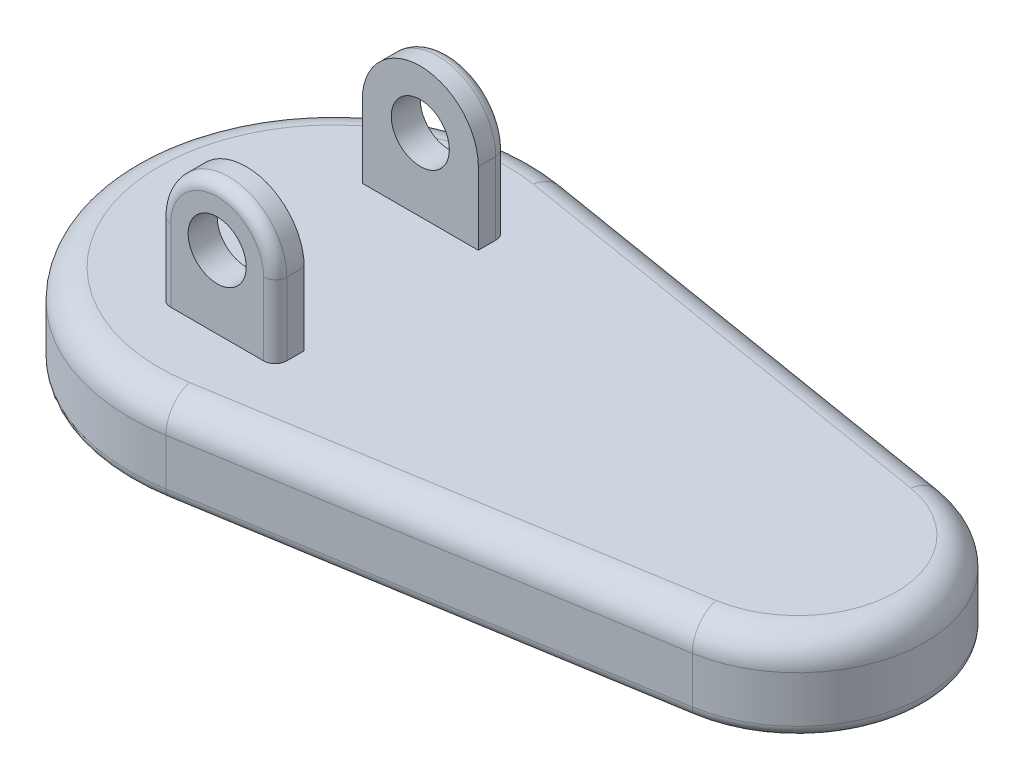
from build123d import *

# Parameters (mm, degrees)
BOSS_EXTRUDE1_DEPTH = 19.05
SKETCH2_W           = 25.4
SKETCH2_H           = 6.35
BOSS_EXTRUDE2_DEPTH = 38.1
SKETCH3_R           = 6.35
CUT_EXTRUDE1_DEPTH  = 172.685024099
FILLET1_R           = 6.35
FILLET2_R           = 2.54
FILLET3_R           = 2.54


with BuildPart() as part:
    # Sketch1 → Boss-Extrude1 (new body)
    with BuildSketch(Plane(origin=(0, 0, 0), x_dir=(1, 0, 0), z_dir=(0, 1, 0))):
        with BuildLine():
            Line((-94.376875, 43.859194763), (4.54025, 27.568636708))
            ThreePointArc((4.54025, 27.568636708), (27.94, 0), (4.54025, -27.568636708))
            Line((4.54025, -27.568636708), (-94.376875, -43.859194763))
            ThreePointArc((-94.376875, -43.859194763), (-146.05, 0), (-94.376875, 43.859194763))
        make_face()
    extrude(amount=BOSS_EXTRUDE1_DEPTH)

    # Sketch2 → Boss-Extrude2 (add)
    with BuildSketch(Plane(origin=(0, 19.05, 0), x_dir=(1, 0, 0), z_dir=(0, 1, 0))):
        with Locations((-101.6, 22.225)):
            Rectangle(SKETCH2_W, SKETCH2_H)
        with Locations((-101.6, -22.225)):
            Rectangle(SKETCH2_W, SKETCH2_H)
    extrude(amount=BOSS_EXTRUDE2_DEPTH)

    # Sketch3 → Cut-Extrude1 (cut, through all)
    with BuildSketch(Plane.XY.offset(25.4)):
        with BuildLine():
            Line((-114.3, 57.15), (-114.3, 34.925))
            ThreePointArc((-114.3, 34.925), (-101.6, 47.625), (-88.9, 34.925))
            Line((-88.9, 34.925), (-88.9, 57.15))
            Line((-88.9, 57.15), (-114.3, 57.15))
        make_face()
        with Locations((-101.6, 34.925)):
            Circle(SKETCH3_R)
    extrude(amount=-CUT_EXTRUDE1_DEPTH, mode=Mode.SUBTRACT)

    # Fillet1
    fillet1_edges = [part.edges().sort_by_distance(p)[0] for p in [
        (27.94, 19.05, 0),
        (-44.9183125, 19.05, -35.713915735),
        (-146.05, 19.05, 0),
        (-44.9183125, 19.05, 35.713915735),
    ]]
    fillet(fillet1_edges, radius=FILLET1_R)

    # Fillet2
    fillet2_edges = [part.edges().sort_by_distance(p)[0] for p in [
        (-44.9183125, 0, -35.713915735),
        (27.94, 0, 0),
        (-44.9183125, 0, 35.713915735),
        (-146.05, 0, 0),
    ]]
    fillet(fillet2_edges, radius=FILLET2_R)

    # Fillet3
    fillet3_edges = [part.edges().sort_by_distance(p)[0] for p in [
        (-88.9, 26.9875, 25.4),
        (-114.3, 26.9875, 25.4),
        (-114.3, 26.9875, -25.4),
        (-88.9, 26.9875, -25.4),
        (-101.6, 47.625, -25.4),
        (-101.6, 47.625, 25.4),
    ]]
    fillet(fillet3_edges, radius=FILLET3_R)


solid = part.part
